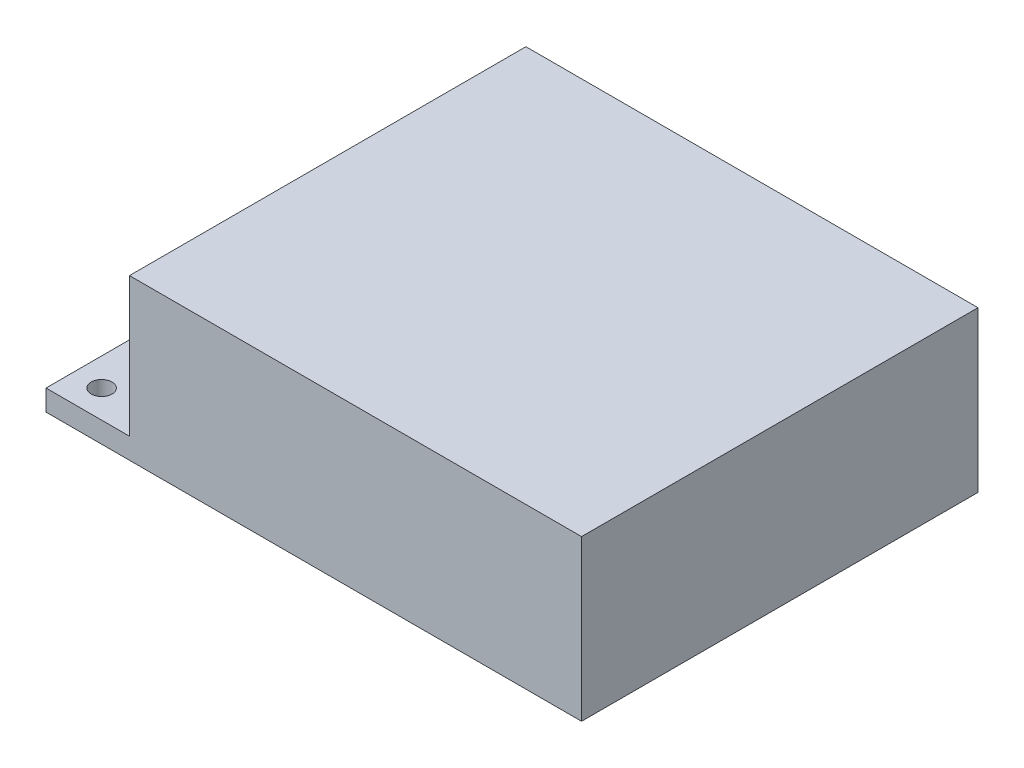
from build123d import *

# Parameters (mm, degrees)
SKETCH1_W           = 77
SKETCH1_H           = 57
SKETCH1_R           = 1.5
BOSS_EXTRUDE1_DEPTH = 3
SKETCH2_W           = 65
SKETCH2_H           = 57
BOSS_EXTRUDE2_DEPTH = 20


with BuildPart() as part:
    # Sketch1 → Boss-Extrude1 (new body)
    with BuildSketch(Plane(origin=(0, 0, 0), x_dir=(1, 0, 0), z_dir=(0, 1, 0))):
        Rectangle(SKETCH1_W, SKETCH1_H)
        with Locations(Location((-34.5, 24.5, 0), (0, 0, 270))):
            Circle(SKETCH1_R, mode=Mode.SUBTRACT)
        with Locations(Location((-34.5, -24.5, 0), (0, 0, 270))):
            Circle(SKETCH1_R, mode=Mode.SUBTRACT)
    extrude(amount=BOSS_EXTRUDE1_DEPTH)

    # Sketch2 → Boss-Extrude2 (add)
    with BuildSketch(Plane(origin=(0, 3, 0), x_dir=(1, 0, 0), z_dir=(0, 1, 0))):
        with Locations((6, 0)):
            Rectangle(SKETCH2_W, SKETCH2_H)
    extrude(amount=BOSS_EXTRUDE2_DEPTH)


solid = part.part
